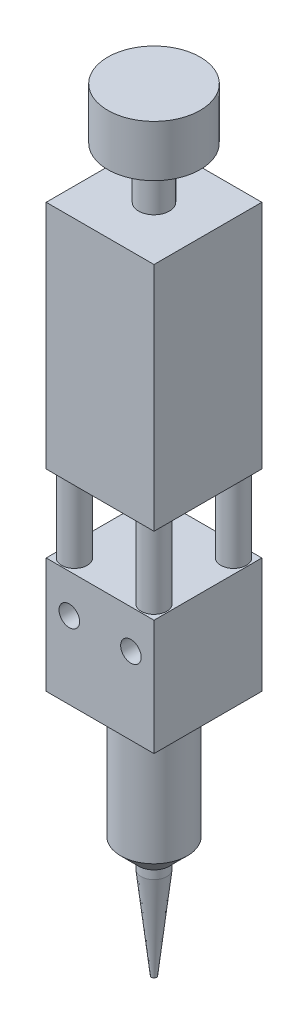
from build123d import *

# Parameters (mm, degrees)
SKETCH_1_W            = 21
SKETCH_1_H            = 21
EXTRUDE_279_DEPTH     = 22.5
HOLE_WIZARD_4_0_4_1_D = 4
SKETCH_9_R            = 2.5
EXTRUDE_1_DEPTH       = 15
SKETCH_10_W           = 21
SKETCH_10_H           = 21
EXTRUDE_2_DEPTH       = 45


with BuildPart() as part:
    # Эскиз1 → Extrude 279 (new body)
    with BuildSketch(Plane(origin=(0, 0, 0), x_dir=(1, 0, 0), z_dir=(0, 1, 0))):
        Rectangle(SKETCH_1_W, SKETCH_1_H)
    extrude(amount=EXTRUDE_279_DEPTH)

    # Эскиз2 → Повернуть1 (revolve)
    with BuildSketch(Plane.XY, mode=Mode.PRIVATE) as revolve_1_sk:
        Polygon((0, 0), (6.5, 0), (6.5, -24.5), (3, -28), (0, -28), align=None)
    revolve(revolve_1_sk.sketch.rotate(Axis((0, -28, 0), (0, 1, 0)), 90), axis=Axis((0, -28, 0), (0, 1, 0)))

    # Диаметр отверстия Ø4.0 (4)1 (through all)
    with Locations(Plane.XY.offset(10.5)):
        with Locations((-6, 15), (6, 15)):
            Hole(HOLE_WIZARD_4_0_4_1_D / 2)

    # Эскиз8 → Повернуть4 (revolve)
    with BuildSketch(Plane.XY, mode=Mode.PRIVATE) as revolve_4_sk:
        Polygon((0.25, -28), (2.5, -28), (2.5, -30), (0.5, -48), (0.25, -48), align=None)
    revolve(revolve_4_sk.sketch.rotate(Axis((0, -28, 0), (0, -1, 0)), 90), axis=Axis((0, -28, 0), (0, -1, 0)))

    # Эскиз9 → Бобышка-Вытянуть1 (add)
    with BuildSketch(Plane(origin=(0, 22.5, 0), x_dir=(1, 0, 0), z_dir=(0, 1, 0))):
        with Locations(Location((-7.75, 7.75, 0), (0, 0, 270))):
            Circle(SKETCH_9_R)
        with Locations(Location((7.75, 7.75, 0), (0, 0, 270))):
            Circle(SKETCH_9_R)
        with Locations(Location((7.75, -7.75, 0), (0, 0, 270))):
            Circle(SKETCH_9_R)
        with Locations(Location((-7.75, -7.75, 0), (0, 0, 270))):
            Circle(SKETCH_9_R)
    extrude(amount=EXTRUDE_1_DEPTH)

    # Эскиз10 → Бобышка-Вытянуть2 (add)
    with BuildSketch(Plane(origin=(0, 37.5, 0), x_dir=(1, 0, 0), z_dir=(0, 1, 0))):
        Rectangle(SKETCH_10_W, SKETCH_10_H)
    extrude(amount=EXTRUDE_2_DEPTH)

    # Эскиз7 → Повернуть3 (revolve)
    with BuildSketch(Plane.XY, mode=Mode.PRIVATE) as revolve_3_sk:
        Polygon((0, 82.5), (0, 102.5), (9, 102.5), (9, 92.5), (3, 92.5), (3, 82.5), align=None)
    revolve(revolve_3_sk.sketch.rotate(Axis((0, 82.5, 0), (0, 1, 0)), 90), axis=Axis((0, 82.5, 0), (0, 1, 0)))


solid = part.part
